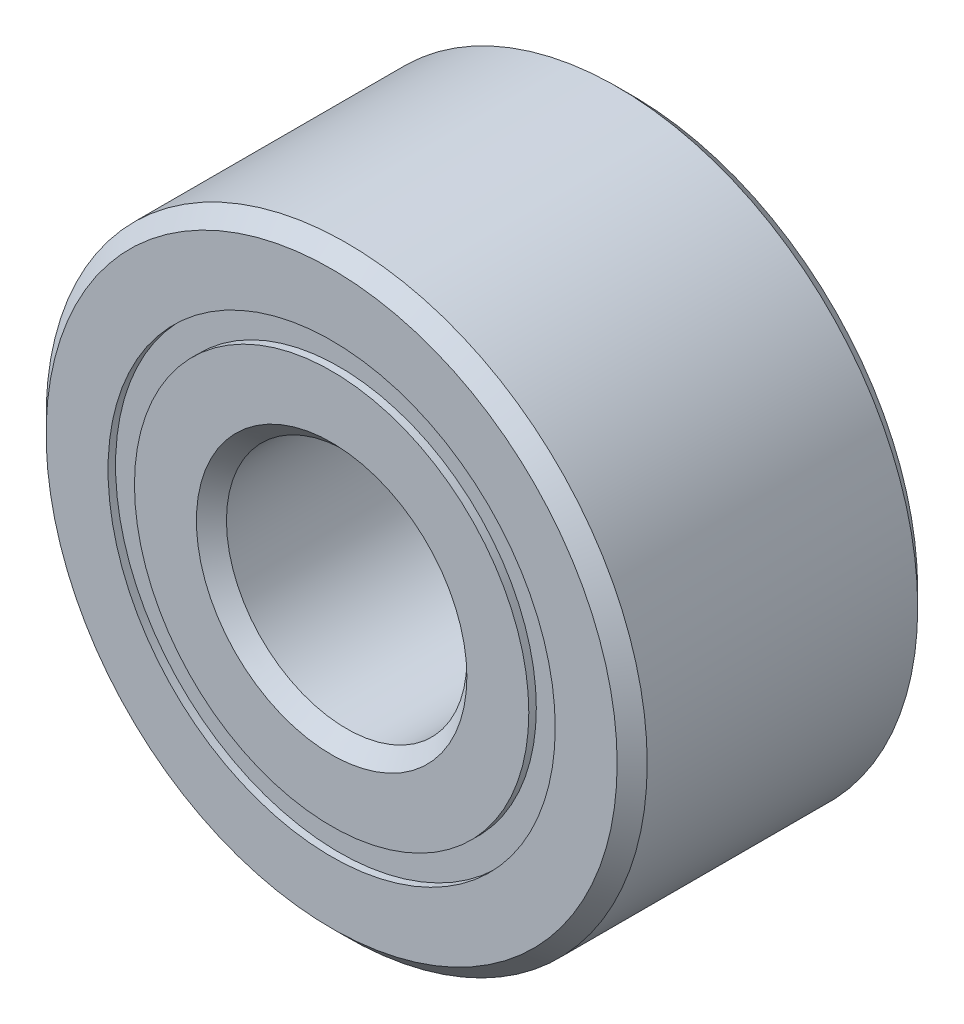
from build123d import *

# Parameters (mm, degrees)
CIRPATTERN1_COUNT = 12
SKETCH5_W         = 0.621180469
SKETCH5_H         = 0.21978022


with BuildPart() as part:
    # Sketch1 → Revolve1 (revolve)
    with BuildSketch(Plane(origin=(0, 0, 0), x_dir=(0, 0, -1), z_dir=(1, 0, 0))):
        with BuildLine():
            Line((1.125, 2.5), (-1.125, 2.5))
            Line((-1.125, 2.5), (-1.25, 2.375))
            Line((-1.25, 2.375), (-1.25, 1.85989011))
            Line((-1.25, 1.85989011), (-0.555555556, 1.85989011))
            ThreePointArc((-0.555555556, 1.85989011), (0, 2.316319531), (0.555555556, 1.85989011))
            Line((0.555555556, 1.85989011), (1.25, 1.85989011))
            Line((1.25, 1.85989011), (1.25, 2.375))
            Line((1.25, 2.375), (1.125, 2.5))
        make_face()
    revolve(axis=Axis((0, 0, 1.25), (0, 0, -1)))


with BuildPart() as body_2:
    # Sketch3 → Revolve3 (revolve)
    with BuildSketch(Plane(origin=(0, 0, 0), x_dir=(0, 0, -1), z_dir=(1, 0, 0))):
        with BuildLine():
            Line((-1.25, 1.64010989), (-0.555555556, 1.64010989))
            ThreePointArc((-0.555555556, 1.64010989), (0, 1.183680469), (0.555555556, 1.64010989))
            Line((0.555555556, 1.64010989), (1.25, 1.64010989))
            Line((1.25, 1.64010989), (1.25, 1.125))
            Line((1.25, 1.125), (1.125, 1))
            Line((1.125, 1), (-1.125, 1))
            Line((-1.125, 1), (-1.25, 1.125))
            Line((-1.25, 1.125), (-1.25, 1.64010989))
        make_face()
    revolve(axis=Axis((0, 0, 1.25), (0, 0, -1)))


with BuildPart() as body_3:
    # Sketch4 → Revolve4 (revolve)
    with BuildSketch(Plane(origin=(0, 0, 0), x_dir=(0, 0, -1), z_dir=(1, 0, 0))):
        with BuildLine():
            Line((-0.566319531, 1.75), (0.566319531, 1.75))
            ThreePointArc((0.566319531, 1.75), (0, 2.316319531), (-0.566319531, 1.75))
        make_face()
    revolve(axis=Axis((0, 1.75, 0.566319531), (0, 0, -1)))


with BuildPart() as cirpattern1_1:
    # CirPattern1: pattern copy
    add(body_3.part.rotate(Axis((0, 0, -1.25), (0, 0, 1)), 1 * 360 / CIRPATTERN1_COUNT))


with BuildPart() as cirpattern1_2:
    # CirPattern1: pattern copy
    add(body_3.part.rotate(Axis((0, 0, -1.25), (0, 0, 1)), 2 * 360 / CIRPATTERN1_COUNT))


with BuildPart() as cirpattern1_3:
    # CirPattern1: pattern copy
    add(body_3.part.rotate(Axis((0, 0, -1.25), (0, 0, 1)), 3 * 360 / CIRPATTERN1_COUNT))


with BuildPart() as cirpattern1_4:
    # CirPattern1: pattern copy
    add(body_3.part.rotate(Axis((0, 0, -1.25), (0, 0, 1)), 4 * 360 / CIRPATTERN1_COUNT))


with BuildPart() as cirpattern1_5:
    # CirPattern1: pattern copy
    add(body_3.part.rotate(Axis((0, 0, -1.25), (0, 0, 1)), 5 * 360 / CIRPATTERN1_COUNT))


with BuildPart() as cirpattern1_6:
    # CirPattern1: pattern copy
    add(body_3.part.rotate(Axis((0, 0, -1.25), (0, 0, 1)), 6 * 360 / CIRPATTERN1_COUNT))


with BuildPart() as cirpattern1_7:
    # CirPattern1: pattern copy
    add(body_3.part.rotate(Axis((0, 0, -1.25), (0, 0, 1)), 7 * 360 / CIRPATTERN1_COUNT))


with BuildPart() as cirpattern1_8:
    # CirPattern1: pattern copy
    add(body_3.part.rotate(Axis((0, 0, -1.25), (0, 0, 1)), 8 * 360 / CIRPATTERN1_COUNT))


with BuildPart() as cirpattern1_9:
    # CirPattern1: pattern copy
    add(body_3.part.rotate(Axis((0, 0, -1.25), (0, 0, 1)), 9 * 360 / CIRPATTERN1_COUNT))


with BuildPart() as cirpattern1_10:
    # CirPattern1: pattern copy
    add(body_3.part.rotate(Axis((0, 0, -1.25), (0, 0, 1)), 10 * 360 / CIRPATTERN1_COUNT))


with BuildPart() as cirpattern1_11:
    # CirPattern1: pattern copy
    add(body_3.part.rotate(Axis((0, 0, -1.25), (0, 0, 1)), 11 * 360 / CIRPATTERN1_COUNT))


with BuildPart() as body_15:
    # Sketch5 → Revolve5 (revolve)
    with BuildSketch(Plane(origin=(0, 0, 0), x_dir=(0, 0, -1), z_dir=(1, 0, 0))):
        with Locations((-0.876909765, 1.75)):
            Rectangle(SKETCH5_W, SKETCH5_H)
        with Locations((0.876909765, 1.75)):
            Rectangle(SKETCH5_W, SKETCH5_H)
    revolve(axis=Axis((0, 0, 1.25), (0, 0, -1)))


solid = Compound([part.part, body_2.part, body_3.part, cirpattern1_1.part, cirpattern1_2.part, cirpattern1_3.part, cirpattern1_4.part, cirpattern1_5.part, cirpattern1_6.part, cirpattern1_7.part, cirpattern1_8.part, cirpattern1_9.part, cirpattern1_10.part, cirpattern1_11.part, body_15.part])
